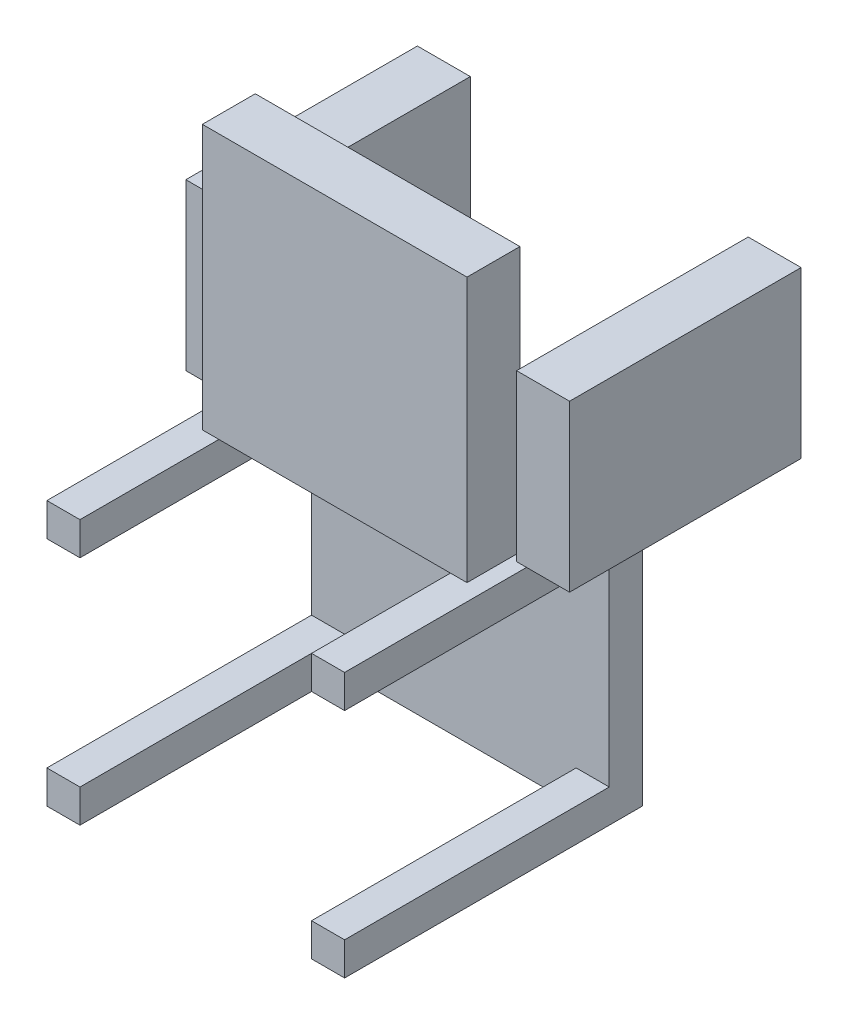
from build123d import *

# Parameters (mm, degrees)
SKETCH_1_W      = 450
SKETCH_1_H      = 400
EXTRUDE_1_DEPTH = 50
SKETCH_2_W      = 50
SKETCH_2_H      = 50
EXTRUDE_2_DEPTH = 450
SKETCH_3_W      = 50
SKETCH_3_H      = 50
EXTRUDE_3_DEPTH = 450
SKETCH_4_W      = 50
SKETCH_4_H      = 50
EXTRUDE_4_DEPTH = 450
SKETCH_5_W      = 50
SKETCH_5_H      = 50
EXTRUDE_5_DEPTH = 450
SKETCH_6_W      = 400
SKETCH_6_H      = 80
EXTRUDE_6_DEPTH = 400
SKETCH_7_W      = 80
SKETCH_7_H      = 350
EXTRUDE_7_DEPTH = 250
SKETCH_8_W      = 80
SKETCH_8_H      = 350
EXTRUDE_8_DEPTH = 250


with BuildPart() as part:
    # 草图1 → 凸台-拉伸1 (new body)
    with BuildSketch(Plane.XY):
        Rectangle(SKETCH_1_W, SKETCH_1_H)
    extrude(amount=EXTRUDE_1_DEPTH)

    # 草图2 → 凸台-拉伸2 (add)
    with BuildSketch(Plane.XY):
        with Locations((-200, -175)):
            Rectangle(SKETCH_2_W, SKETCH_2_H)
    extrude(amount=EXTRUDE_2_DEPTH)

    # 草图3 → 凸台-拉伸3 (add)
    with BuildSketch(Plane.XY):
        with Locations((200, -175)):
            Rectangle(SKETCH_3_W, SKETCH_3_H)
    extrude(amount=EXTRUDE_3_DEPTH)

    # 草图4 → 凸台-拉伸4 (add)
    with BuildSketch(Plane.XY):
        with Locations((-200, 175)):
            Rectangle(SKETCH_4_W, SKETCH_4_H)
    extrude(amount=EXTRUDE_4_DEPTH)

    # 草图5 → 凸台-拉伸5 (add)
    with BuildSketch(Plane.XY):
        with Locations((200, 175)):
            Rectangle(SKETCH_5_W, SKETCH_5_H)
    extrude(amount=EXTRUDE_5_DEPTH)

    # 草图6 → 凸台-拉伸6 (add)
    with BuildSketch(Plane(origin=(0, 200, 0), x_dir=(1, 0, 0), z_dir=(0, 1, 0))):
        with Locations((0, -200)):
            Rectangle(SKETCH_6_W, SKETCH_6_H)
    extrude(amount=EXTRUDE_6_DEPTH)

    # 草图7 → 凸台-拉伸7 (add)
    with BuildSketch(Plane(origin=(0, 200, 0), x_dir=(1, 0, 0), z_dir=(0, 1, 0))):
        with Locations((-250, 0)):
            Rectangle(SKETCH_7_W, SKETCH_7_H)
    extrude(amount=EXTRUDE_7_DEPTH)

    # 草图8 → 凸台-拉伸8 (add)
    with BuildSketch(Plane(origin=(0, 200, 0), x_dir=(1, 0, 0), z_dir=(0, 1, 0))):
        with Locations((250, 0)):
            Rectangle(SKETCH_8_W, SKETCH_8_H)
    extrude(amount=EXTRUDE_8_DEPTH)


solid = part.part
